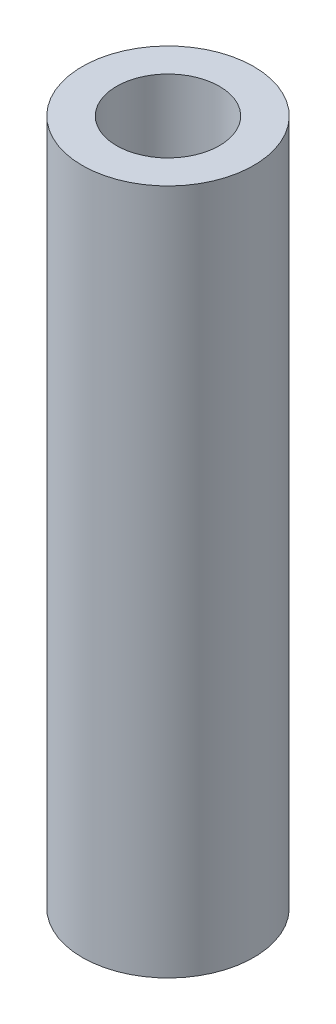
from build123d import *

# Parameters (mm, degrees)
SKETCH1_R           = 2.5
SKETCH1_R_2         = 1.5
BOSS_EXTRUDE1_DEPTH = 10


with BuildPart() as part:
    # Sketch1 → Boss-Extrude1 (new, symmetric)
    with BuildSketch(Plane(origin=(0, 0, 0), x_dir=(1, 0, 0), z_dir=(0, 1, 0))):
        with Locations(Location((0, 0, 0), (0, 0, 270))):
            Circle(SKETCH1_R)
        with Locations(Location((0, 0, 0), (0, 0, 270))):
            Circle(SKETCH1_R_2, mode=Mode.SUBTRACT)
    extrude(amount=BOSS_EXTRUDE1_DEPTH, both=True)


solid = part.part
